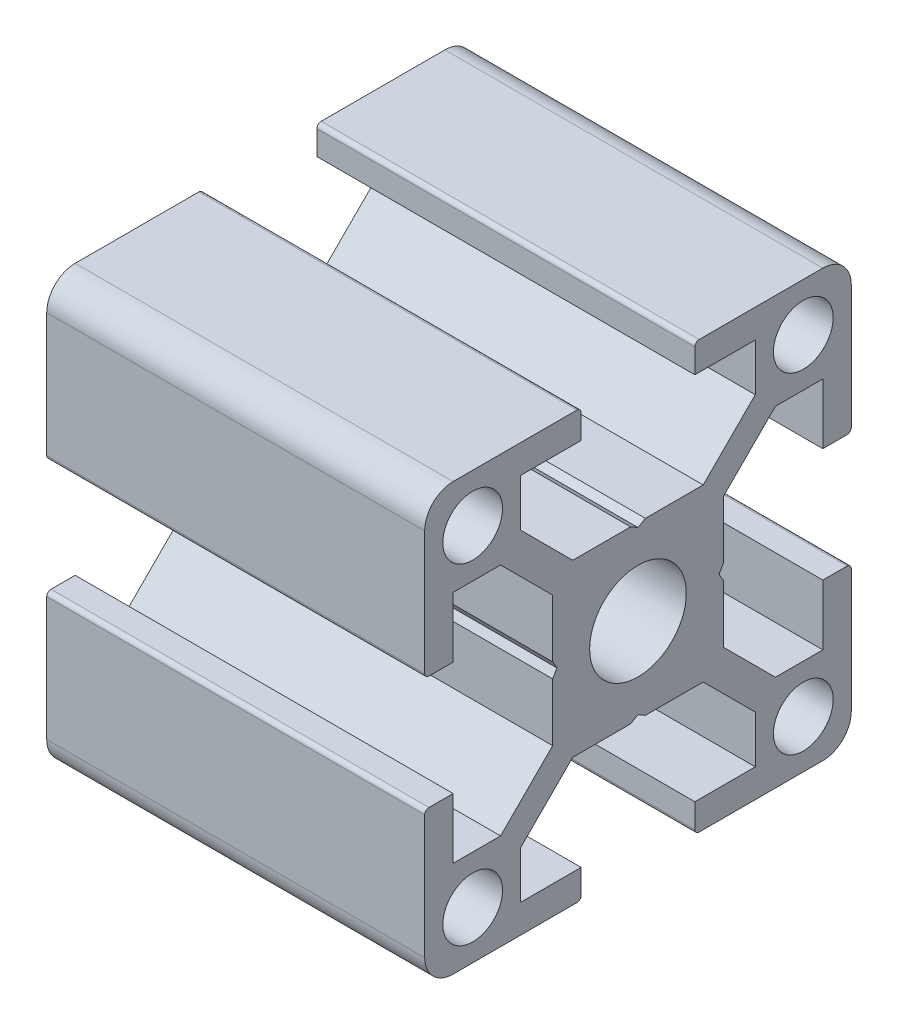
from build123d import *

# Parameters (mm, degrees)
SKETCH_1_R              = 2.1
SKETCH_1_R_2            = 3.4
F_30XS6_30X30S6_1_DEPTH = 26.58


with BuildPart() as part:
    # 草图1 → 30xs6 30X30S6(1) (new body)
    with BuildSketch(Plane.YZ):
        with BuildLine():
            Line((-14.7, 4), (-13, 4))
            Line((-13, 4), (-13, 8.25))
            Line((-13, 8.25), (-9.664213562, 8.25))
            Line((-9.664213562, 8.25), (-6, 4.585786438))
            Line((-6, 4.585786438), (-6, 0.519615242))
            Line((-6, 0.519615242), (-5.7, 0))
            Line((-5.7, 0), (-6, -0.519615242))
            Line((-6, -0.519615242), (-6, -4.585786438))
            Line((-6, -4.585786438), (-9.664213562, -8.25))
            Line((-9.664213562, -8.25), (-13, -8.25))
            Line((-13, -8.25), (-13, -4))
            Line((-13, -4), (-14.7, -4))
            ThreePointArc((-14.7, -4), (-14.912132034, -4.087867966), (-15, -4.3))
            Line((-15, -4.3), (-15, -13))
            ThreePointArc((-15, -13), (-14.414213562, -14.414213562), (-13, -15))
            Line((-13, -15), (-4.3, -15))
            ThreePointArc((-4.3, -15), (-4.087867966, -14.912132034), (-4, -14.7))
            Line((-4, -14.7), (-4, -13))
            Line((-4, -13), (-8.25, -13))
            Line((-8.25, -13), (-8.25, -9.664213562))
            Line((-8.25, -9.664213562), (-4.585786438, -6))
            Line((-4.585786438, -6), (-0.519615242, -6))
            Line((-0.519615242, -6), (0, -5.7))
            Line((0, -5.7), (0.519615242, -6))
            Line((0.519615242, -6), (4.585786438, -6))
            Line((4.585786438, -6), (8.25, -9.664213562))
            Line((8.25, -9.664213562), (8.25, -13))
            Line((8.25, -13), (4, -13))
            Line((4, -13), (4, -14.7))
            ThreePointArc((4, -14.7), (4.087867966, -14.912132034), (4.3, -15))
            Line((4.3, -15), (13, -15))
            ThreePointArc((13, -15), (14.414213562, -14.414213562), (15, -13))
            Line((15, -13), (15, -4.3))
            ThreePointArc((15, -4.3), (14.912132034, -4.087867966), (14.7, -4))
            Line((14.7, -4), (13, -4))
            Line((13, -4), (13, -8.25))
            Line((13, -8.25), (9.664213562, -8.25))
            Line((9.664213562, -8.25), (6, -4.585786438))
            Line((6, -4.585786438), (6, -0.519615242))
            Line((6, -0.519615242), (5.7, 0))
            Line((5.7, 0), (6, 0.519615242))
            Line((6, 0.519615242), (6, 4.585786438))
            Line((6, 4.585786438), (9.664213562, 8.25))
            Line((9.664213562, 8.25), (13, 8.25))
            Line((13, 8.25), (13, 4))
            Line((13, 4), (14.7, 4))
            ThreePointArc((14.7, 4), (14.912132034, 4.087867966), (15, 4.3))
            Line((15, 4.3), (15, 13))
            ThreePointArc((15, 13), (14.414213562, 14.414213562), (13, 15))
            Line((13, 15), (4.3, 15))
            ThreePointArc((4.3, 15), (4.087867966, 14.912132034), (4, 14.7))
            Line((4, 14.7), (4, 13))
            Line((4, 13), (8.25, 13))
            Line((8.25, 13), (8.25, 9.664213562))
            Line((8.25, 9.664213562), (4.585786438, 6))
            Line((4.585786438, 6), (0.519615242, 6))
            Line((0.519615242, 6), (0, 5.7))
            Line((0, 5.7), (-0.519615242, 6))
            Line((-0.519615242, 6), (-4.585786438, 6))
            Line((-4.585786438, 6), (-8.25, 9.664213562))
            Line((-8.25, 9.664213562), (-8.25, 13))
            Line((-8.25, 13), (-4, 13))
            Line((-4, 13), (-4, 14.7))
            ThreePointArc((-4, 14.7), (-4.087867966, 14.912132034), (-4.3, 15))
            Line((-4.3, 15), (-13, 15))
            ThreePointArc((-13, 15), (-14.414213562, 14.414213562), (-15, 13))
            Line((-15, 13), (-15, 4.3))
            ThreePointArc((-15, 4.3), (-14.912132034, 4.087867966), (-14.7, 4))
        make_face()
        with Locations((11.625, 11.625)):
            Circle(SKETCH_1_R, mode=Mode.SUBTRACT)
        with Locations((11.625, -11.625)):
            Circle(SKETCH_1_R, mode=Mode.SUBTRACT)
        Circle(SKETCH_1_R_2, mode=Mode.SUBTRACT)
        with Locations((-11.625, -11.625)):
            Circle(SKETCH_1_R, mode=Mode.SUBTRACT)
        with Locations((-11.625, 11.625)):
            Circle(SKETCH_1_R, mode=Mode.SUBTRACT)
    extrude(amount=F_30XS6_30X30S6_1_DEPTH)


solid = part.part
